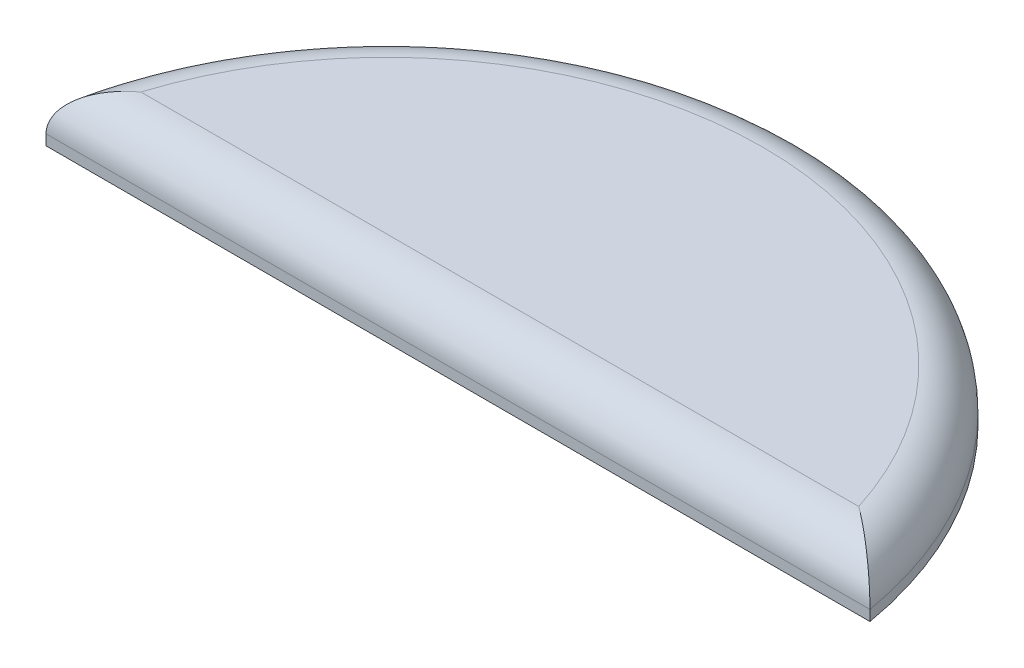
from build123d import *

# Parameters (mm, degrees)
BOSS_EXTRUDE1_DEPTH = 5
FILLET1_R           = 4


with BuildPart() as part:
    # Sketch1 → Boss-Extrude1 (new body)
    with BuildSketch(Plane(origin=(0, 0, 0), x_dir=(1, 0, 0), z_dir=(0, 1, 0))):
        with BuildLine():
            Line((-41.985543478, 0), (36.844456522, 0))
            ThreePointArc((36.844456522, 0), (-2.570543478, 33.184005942), (-41.985543478, 0))
        make_face()
    extrude(amount=BOSS_EXTRUDE1_DEPTH)

    # Fillet1
    fillet1_edges = [part.edges().sort_by_distance(p)[0] for p in [
        (-2.570543478, 5, -33.184005942),
        (-2.570543478, 5, 0),
    ]]
    fillet(fillet1_edges, radius=FILLET1_R)


solid = part.part
